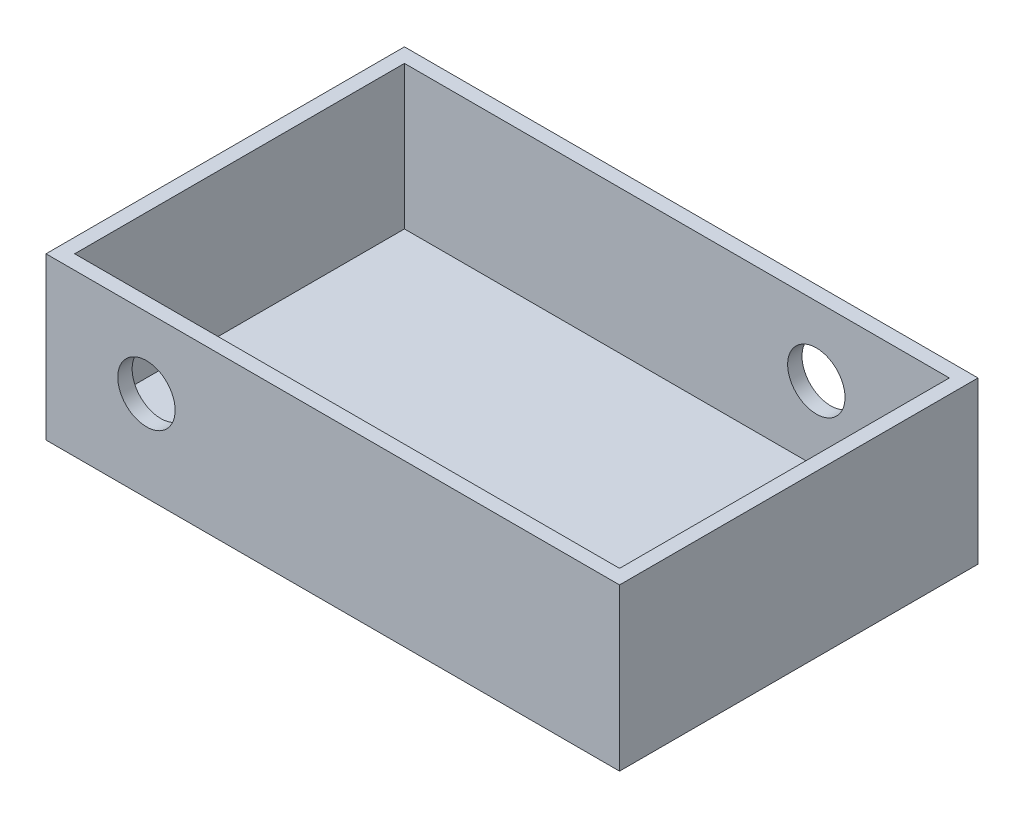
from build123d import *

# Parameters (mm, degrees)
SKETCH1_W           = 80
SKETCH1_H           = 50
BOSS_EXTRUDE1_DEPTH = 2.5
SKETCH2_W           = 80
SKETCH2_H           = 50
SKETCH2_W_2         = 76
SKETCH2_H_2         = 46
BOSS_EXTRUDE2_DEPTH = 20
SKETCH3_R           = 4
CUT_EXTRUDE1_DEPTH  = 20
SKETCH4_R           = 4
CUT_EXTRUDE2_DEPTH  = 20


with BuildPart() as part:
    # Sketch1 → Boss-Extrude1 (new body)
    with BuildSketch(Plane(origin=(0, 0, 0), x_dir=(1, 0, 0), z_dir=(0, 1, 0))):
        with Locations((40, -25)):
            Rectangle(SKETCH1_W, SKETCH1_H)
    extrude(amount=BOSS_EXTRUDE1_DEPTH)

    # Sketch2 → Boss-Extrude2 (add)
    with BuildSketch(Plane(origin=(0, 2.5, 0), x_dir=(1, 0, 0), z_dir=(0, 1, 0))):
        with Locations((40, -25)):
            Rectangle(SKETCH2_W, SKETCH2_H)
        with Locations((40, -25)):
            Rectangle(SKETCH2_W_2, SKETCH2_H_2, mode=Mode.SUBTRACT)
    extrude(amount=BOSS_EXTRUDE2_DEPTH)

    # Sketch3 → Cut-Extrude1 (cut)
    with BuildSketch(Plane.XY.offset(50)):
        with Locations((14.013555164, 12.601165946)):
            Circle(SKETCH3_R)
    extrude(amount=-CUT_EXTRUDE1_DEPTH, mode=Mode.SUBTRACT)

    # Sketch4 → Cut-Extrude2 (cut)
    with BuildSketch(Plane.XY.offset(2)):
        with Locations((59.449039137, 12.859939565)):
            Circle(SKETCH4_R)
    extrude(amount=-CUT_EXTRUDE2_DEPTH, mode=Mode.SUBTRACT)


solid = part.part
